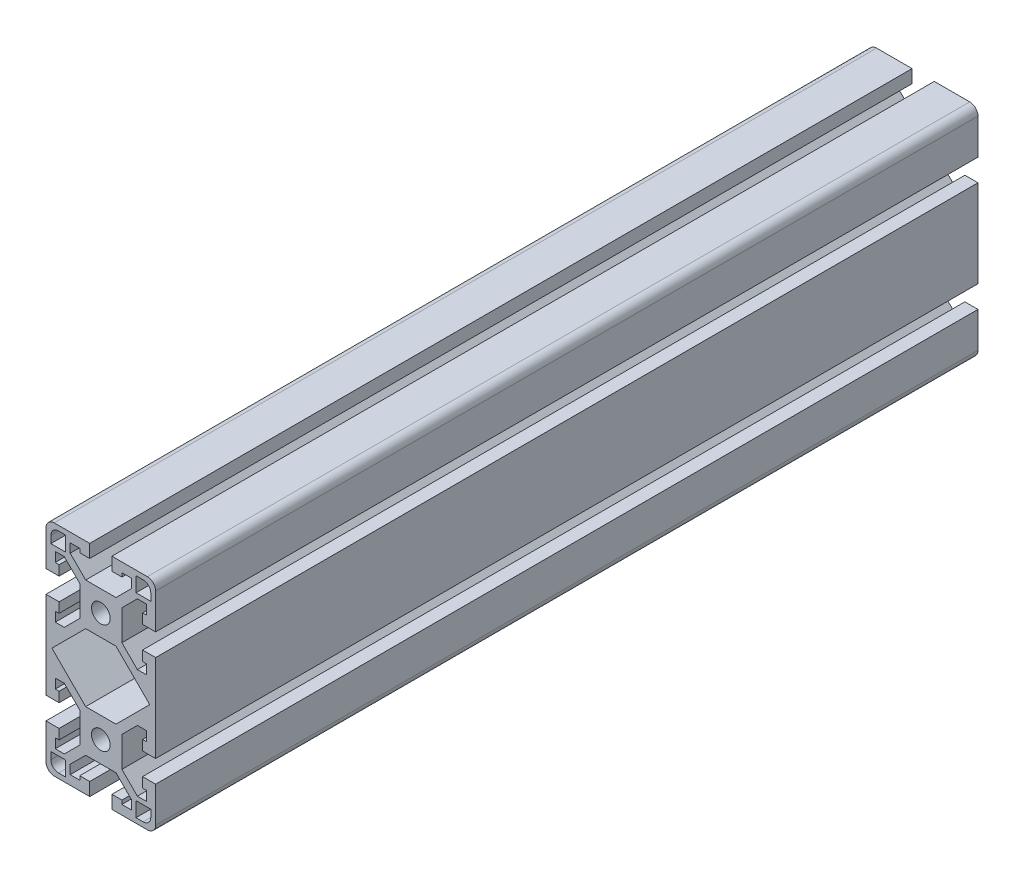
from build123d import *

# Parameters (mm, degrees)
SKETCH2_R                            = 3.35
F_40_SERIES_TS40_80LM_650037_1_DEPTH = 300
M8X1_25_TAPPED_HOLE1_AT_2_COUNT      = 2
M8X1_25_TAPPED_HOLE1_AT_2_PITCH      = 40


with BuildPart() as part:
    # Sketch2 → 40 series TS40-80LM-650037(1) (new body)
    with BuildSketch(Plane(origin=(0, 0, 150), x_dir=(-1, 0, 0), z_dir=(0, 0, -1))):
        with BuildLine():
            Line((0, -27.681), (-5.525738531, -27.681))
            Line((-5.525738531, -27.681), (-11.176, -33.331261469))
            Line((-11.176, -33.331261469), (-11.176, -36.6218))
            Line((-11.176, -36.6218), (-7.6835, -36.6218))
            Line((-7.6835, -36.6218), (-7.6835, -35.2248))
            Line((-7.6835, -35.2248), (-4.0488, -35.2248))
            Line((-4.0488, -35.2248), (-4.0488, -40))
            Line((-4.0488, -40), (-17, -40))
            ThreePointArc((-17, -40), (-19.121320344, -39.121320344), (-20, -37))
            Line((-20, -37), (-20, -24.0488))
            Line((-20, -24.0488), (-15.2248, -24.0488))
            Line((-15.2248, -24.0488), (-15.2248, -27.6835))
            Line((-15.2248, -27.6835), (-16.6218, -27.6835))
            Line((-16.6218, -27.6835), (-16.6218, -31.176))
            Line((-16.6218, -31.176), (-13.331261469, -31.176))
            Line((-13.331261469, -31.176), (-7.681, -25.525738531))
            Line((-7.681, -25.525738531), (-7.681, -20))
            Line((-7.681, -20), (-7.681, -14.474261469))
            Line((-7.681, -14.474261469), (-13.331261469, -8.824))
            Line((-13.331261469, -8.824), (-16.6218, -8.824))
            Line((-16.6218, -8.824), (-16.6218, -12.3165))
            Line((-16.6218, -12.3165), (-15.2248, -12.3165))
            Line((-15.2248, -12.3165), (-15.2248, -15.9512))
            Line((-15.2248, -15.9512), (-20, -15.9512))
            Line((-20, -15.9512), (-20, 15.9512))
            Line((-20, 15.9512), (-15.2248, 15.9512))
            Line((-15.2248, 15.9512), (-15.2248, 12.3165))
            Line((-15.2248, 12.3165), (-16.6218, 12.3165))
            Line((-16.6218, 12.3165), (-16.6218, 8.824))
            Line((-16.6218, 8.824), (-13.331261469, 8.824))
            Line((-13.331261469, 8.824), (-7.681, 14.474261469))
            Line((-7.681, 14.474261469), (-7.681, 25.525738531))
            Line((-7.681, 25.525738531), (-13.331261469, 31.176))
            Line((-13.331261469, 31.176), (-16.6218, 31.176))
            Line((-16.6218, 31.176), (-16.6218, 27.6835))
            Line((-16.6218, 27.6835), (-15.2248, 27.6835))
            Line((-15.2248, 27.6835), (-15.2248, 24.0488))
            Line((-15.2248, 24.0488), (-20, 24.0488))
            Line((-20, 24.0488), (-20, 37))
            ThreePointArc((-20, 37), (-19.121320344, 39.121320344), (-17, 40))
            Line((-17, 40), (-4.0488, 40))
            Line((-4.0488, 40), (-4.0488, 35.2248))
            Line((-4.0488, 35.2248), (-7.6835, 35.2248))
            Line((-7.6835, 35.2248), (-7.6835, 36.6218))
            Line((-7.6835, 36.6218), (-11.176, 36.6218))
            Line((-11.176, 36.6218), (-11.176, 33.331261469))
            Line((-11.176, 33.331261469), (-5.525738531, 27.681))
            Line((-5.525738531, 27.681), (0, 27.681))
            Line((0, 27.681), (5.525738531, 27.681))
            Line((5.525738531, 27.681), (11.176, 33.331261469))
            Line((11.176, 33.331261469), (11.176, 36.6218))
            Line((11.176, 36.6218), (7.6835, 36.6218))
            Line((7.6835, 36.6218), (7.6835, 35.2248))
            Line((7.6835, 35.2248), (4.0488, 35.2248))
            Line((4.0488, 35.2248), (4.0488, 40))
            Line((4.0488, 40), (17, 40))
            ThreePointArc((17, 40), (19.121320344, 39.121320344), (20, 37))
            Line((20, 37), (20, 24.0488))
            Line((20, 24.0488), (15.2248, 24.0488))
            Line((15.2248, 24.0488), (15.2248, 27.6835))
            Line((15.2248, 27.6835), (16.6218, 27.6835))
            Line((16.6218, 27.6835), (16.6218, 31.176))
            Line((16.6218, 31.176), (13.331261469, 31.176))
            Line((13.331261469, 31.176), (7.681, 25.525738531))
            Line((7.681, 25.525738531), (7.681, 20))
            Line((7.681, 20), (7.681, 14.474261469))
            Line((7.681, 14.474261469), (13.331261469, 8.824))
            Line((13.331261469, 8.824), (16.6218, 8.824))
            Line((16.6218, 8.824), (16.6218, 12.3165))
            Line((16.6218, 12.3165), (15.2248, 12.3165))
            Line((15.2248, 12.3165), (15.2248, 15.9512))
            Line((15.2248, 15.9512), (20, 15.9512))
            Line((20, 15.9512), (20, -15.9512))
            Line((20, -15.9512), (15.2248, -15.9512))
            Line((15.2248, -15.9512), (15.2248, -12.3165))
            Line((15.2248, -12.3165), (16.6218, -12.3165))
            Line((16.6218, -12.3165), (16.6218, -8.824))
            Line((16.6218, -8.824), (13.331261469, -8.824))
            Line((13.331261469, -8.824), (7.681, -14.474261469))
            Line((7.681, -14.474261469), (7.681, -20))
            Line((7.681, -20), (7.681, -25.525738531))
            Line((7.681, -25.525738531), (13.331261469, -31.176))
            Line((13.331261469, -31.176), (16.6218, -31.176))
            Line((16.6218, -31.176), (16.6218, -27.6835))
            Line((16.6218, -27.6835), (15.2248, -27.6835))
            Line((15.2248, -27.6835), (15.2248, -24.0488))
            Line((15.2248, -24.0488), (20, -24.0488))
            Line((20, -24.0488), (20, -37))
            ThreePointArc((20, -37), (19.121320344, -39.121320344), (17, -40))
            Line((17, -40), (4.0488, -40))
            Line((4.0488, -40), (4.0488, -35.2248))
            Line((4.0488, -35.2248), (7.6835, -35.2248))
            Line((7.6835, -35.2248), (7.6835, -36.6218))
            Line((7.6835, -36.6218), (11.176, -36.6218))
            Line((11.176, -36.6218), (11.176, -33.331261469))
            Line((11.176, -33.331261469), (5.525738531, -27.681))
            Line((5.525738531, -27.681), (0, -27.681))
        make_face()
        with Locations((0, -20)):
            Circle(SKETCH2_R, mode=Mode.SUBTRACT)
        with Locations((0, 20)):
            Circle(SKETCH2_R, mode=Mode.SUBTRACT)
        Polygon((-5.525738531, 12.319), (-17.844738531, 0), (-5.525738531, -12.319), (0, -12.319), (5.525738531, -12.319), (17.844738531, 0), (5.525738531, 12.319), (0, 12.319), align=None, mode=Mode.SUBTRACT)
        with BuildLine():
            Line((12.8372, 38.222), (12.8372, 32.8372))
            Line((12.8372, 32.8372), (18.222, 32.8372))
            Line((18.222, 32.8372), (18.222, 35.428))
            ThreePointArc((18.222, 35.428), (17.403656347, 37.403656347), (15.428, 38.222))
            Line((15.428, 38.222), (12.8372, 38.222))
        make_face(mode=Mode.SUBTRACT)
        with BuildLine():
            Line((12.8372, -32.8372), (18.222, -32.8372))
            Line((18.222, -32.8372), (18.222, -35.428))
            ThreePointArc((18.222, -35.428), (17.403656347, -37.403656347), (15.428, -38.222))
            Line((15.428, -38.222), (12.8372, -38.222))
            Line((12.8372, -38.222), (12.8372, -32.8372))
        make_face(mode=Mode.SUBTRACT)
        with BuildLine():
            Line((-12.8372, -38.222), (-12.8372, -32.8372))
            Line((-12.8372, -32.8372), (-18.222, -32.8372))
            Line((-18.222, -32.8372), (-18.222, -35.428))
            ThreePointArc((-18.222, -35.428), (-17.403656347, -37.403656347), (-15.428, -38.222))
            Line((-15.428, -38.222), (-12.8372, -38.222))
        make_face(mode=Mode.SUBTRACT)
        with BuildLine():
            Line((-18.222, 35.428), (-18.222, 32.8372))
            Line((-18.222, 32.8372), (-12.8372, 32.8372))
            Line((-12.8372, 32.8372), (-12.8372, 38.222))
            Line((-12.8372, 38.222), (-15.428, 38.222))
            ThreePointArc((-15.428, 38.222), (-17.403656347, 37.403656347), (-18.222, 35.428))
        make_face(mode=Mode.SUBTRACT)
    extrude(amount=F_40_SERIES_TS40_80LM_650037_1_DEPTH)

    # Sketch4 → M8x1.25 Tapped Hole1 (revolve, cut)
    with BuildSketch(Plane(origin=(0, -20, 150), x_dir=(0, -1, 0), z_dir=(1, 0, 0))):
        Polygon((0, 0), (0, 32.042926105), (3.4, 30), (3.4, 0), align=None)
    m8x1_25_tapped_hole1 = revolve(axis=Axis((0, -20, 156.35), (0, 0, -1)), mode=Mode.SUBTRACT)

    # M8x1.25 Tapped Hole1 at 2: M8x1.25 Tapped Hole1 ×2
    with Locations(*[(0, i * M8X1_25_TAPPED_HOLE1_AT_2_PITCH, 0) for i in range(1, M8X1_25_TAPPED_HOLE1_AT_2_COUNT)]):
        add(m8x1_25_tapped_hole1, mode=Mode.SUBTRACT)

    # Mirror1: M8x1.25 Tapped Hole1 across plane
    add(m8x1_25_tapped_hole1.mirror(Plane.XY), mode=Mode.SUBTRACT)

    # Mirror1 copy 1 sketch → Mirror1 copy 1 (revolve, cut)
    with BuildSketch(Plane(origin=(0, 20, -150), x_dir=(0, -1, 0), z_dir=(1, 0, 0))):
        Polygon((0, 0), (0, -32.042926105), (3.4, -30), (3.4, 0), align=None)
    revolve(axis=Axis((0, 20, -156.35), (0, 0, -1)), mode=Mode.SUBTRACT)


solid = part.part
